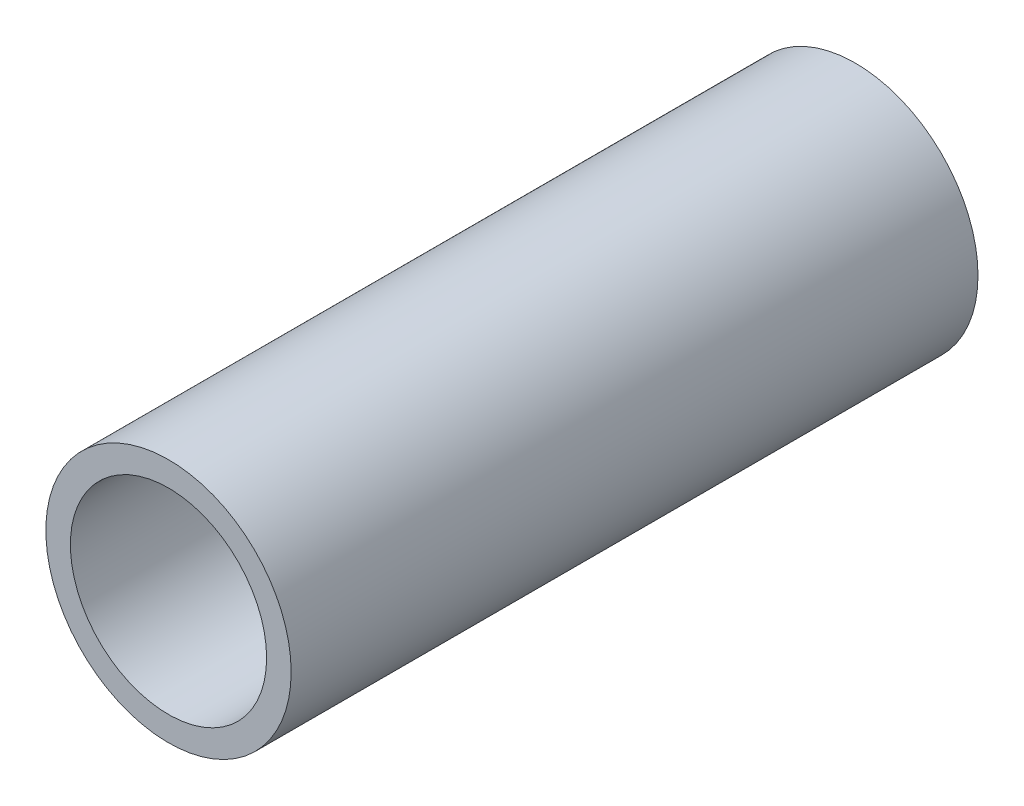
from build123d import *

# Parameters (mm, degrees)
SKETCH1_R           = 7.9375
SKETCH1_R_2         = 6.35
BOSS_EXTRUDE1_DEPTH = 22.225


with BuildPart() as part:
    # Sketch1 → Boss-Extrude1 (new, symmetric)
    with BuildSketch(Plane.XY):
        Circle(SKETCH1_R)
        Circle(SKETCH1_R_2, mode=Mode.SUBTRACT)
    extrude(amount=BOSS_EXTRUDE1_DEPTH, both=True)


solid = part.part
